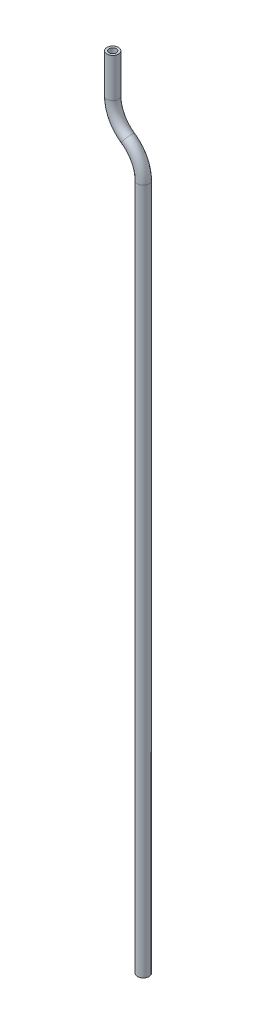
from build123d import *

# Parameters (mm, degrees)
UTILITY_CIRCULAR_CROSS_SECTION_R   = 2
UTILITY_CIRCULAR_CROSS_SECTION_R_2 = 1.25


with BuildPart() as part:
    # Native hollow utility sweep: sweep along a path in Illustrative smooth utility route
    with BuildLine(Plane.XY) as native_hollow_utility_sweep_path:
        Line((-13.55, 0), (-13.55, -13.5))
        ThreePointArc((-13.55, -13.5), (-12.150414231, -19.152999757), (-8.275, -23.5))
        ThreePointArc((-8.275, -23.5), (-4.399585769, -27.847000243), (-3, -33.5))
        Line((-3, -33.5), (-3, -270.5))
    # Utility circular cross section → Native hollow utility sweep (sweep)
    with BuildSketch(Plane(origin=(0, 0, 0), x_dir=(1, 0, 0), z_dir=(0, 1, 0))):
        with Locations((-13.55, 0)):
            Circle(UTILITY_CIRCULAR_CROSS_SECTION_R)
        with Locations((-13.55, 0)):
            Circle(UTILITY_CIRCULAR_CROSS_SECTION_R_2, mode=Mode.SUBTRACT)
    sweep(path=native_hollow_utility_sweep_path.line)


solid = part.part
